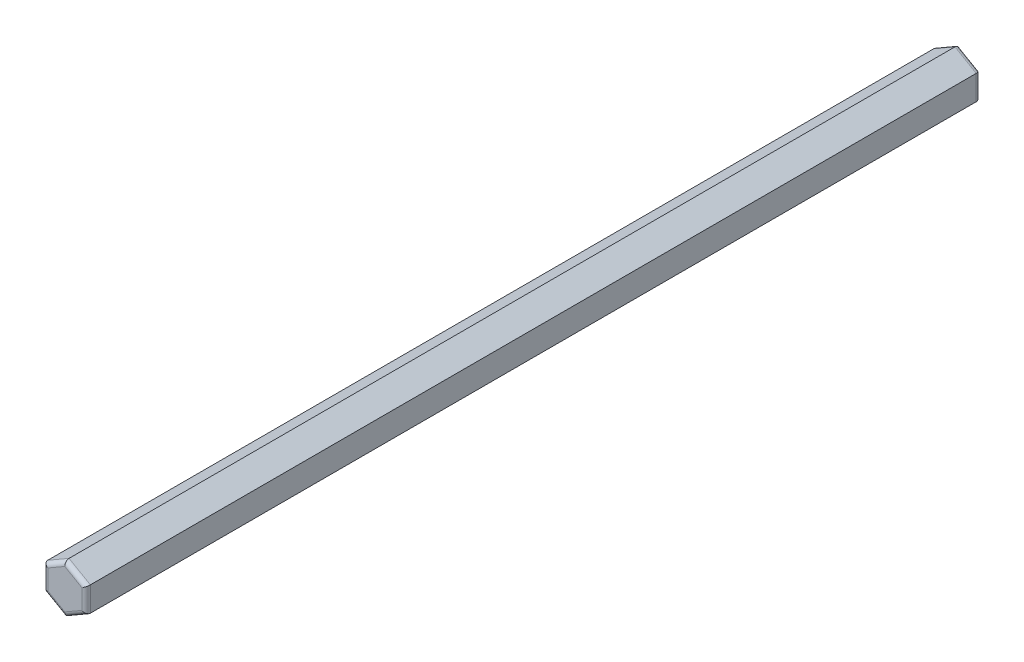
from build123d import *

# Parameters (mm, degrees)
RESSALTO_EXTRUS_O1_DEPTH = 105
FILETE1_R                = 0.5


with BuildPart() as part:
    # Esboço1 → Ressalto-extrusão1 (new body)
    with BuildSketch(Plane.XY.offset(135)):
        Polygon((-55.002122675, 2.886751346), (-57.502122675, 1.443375673), (-57.502122675, -1.443375673), (-55.002122675, -2.886751346), (-52.502122675, -1.443375673), (-52.502122675, 1.443375673), align=None)
    extrude(amount=-RESSALTO_EXTRUS_O1_DEPTH)

    # Filete1
    filete1_edges = [part.edges().sort_by_distance(p)[0] for p in [
        (-57.502122675, 0, 30),
        (-56.252122675, -2.165063509, 30),
        (-53.752122675, -2.165063509, 30),
        (-52.502122675, 0, 30),
        (-53.752122675, 2.165063509, 30),
        (-52.502122675, 0, 135),
        (-53.752122675, -2.165063509, 135),
        (-56.252122675, -2.165063509, 135),
        (-57.502122675, 0, 135),
        (-56.252122675, 2.165063509, 135),
        (-53.752122675, 2.165063509, 135),
        (-56.252122675, 2.165063509, 30),
    ]]
    fillet(filete1_edges, radius=FILETE1_R)


solid = part.part
